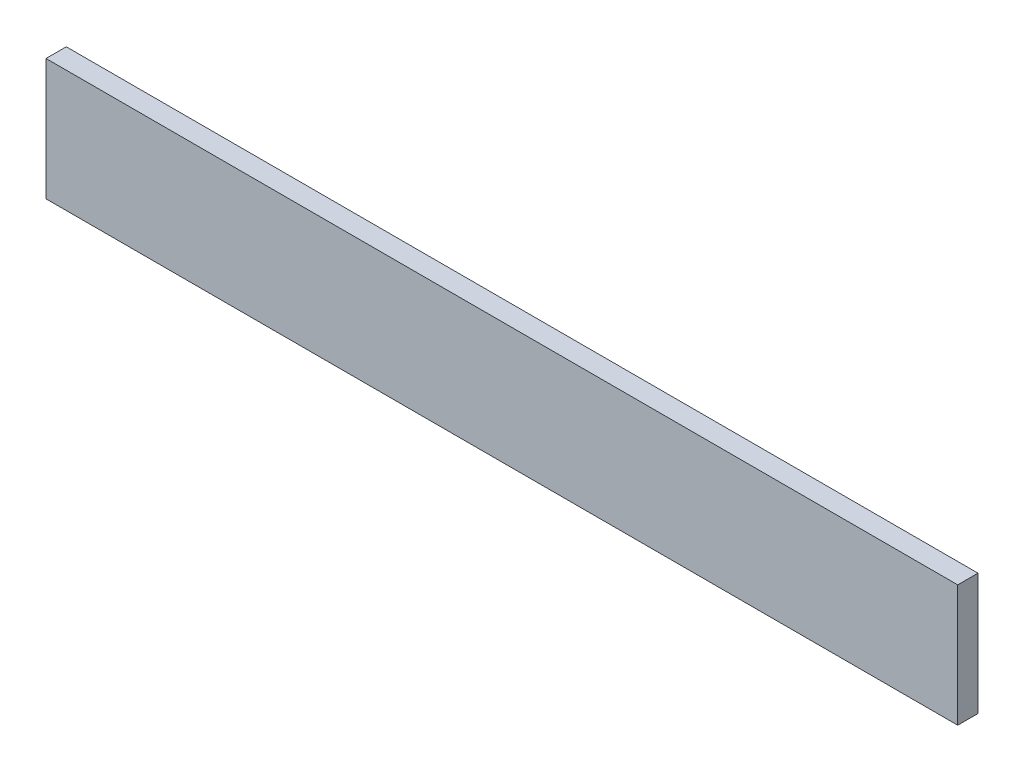
from build123d import *

# Parameters (mm, degrees)
SKETCH1_W           = 225
SKETCH1_H           = 30
BOSS_EXTRUDE1_DEPTH = 5


with BuildPart() as part:
    # Sketch1 → Boss-Extrude1 (new body)
    with BuildSketch(Plane.XY):
        Rectangle(SKETCH1_W, SKETCH1_H)
    extrude(amount=BOSS_EXTRUDE1_DEPTH)


solid = part.part
